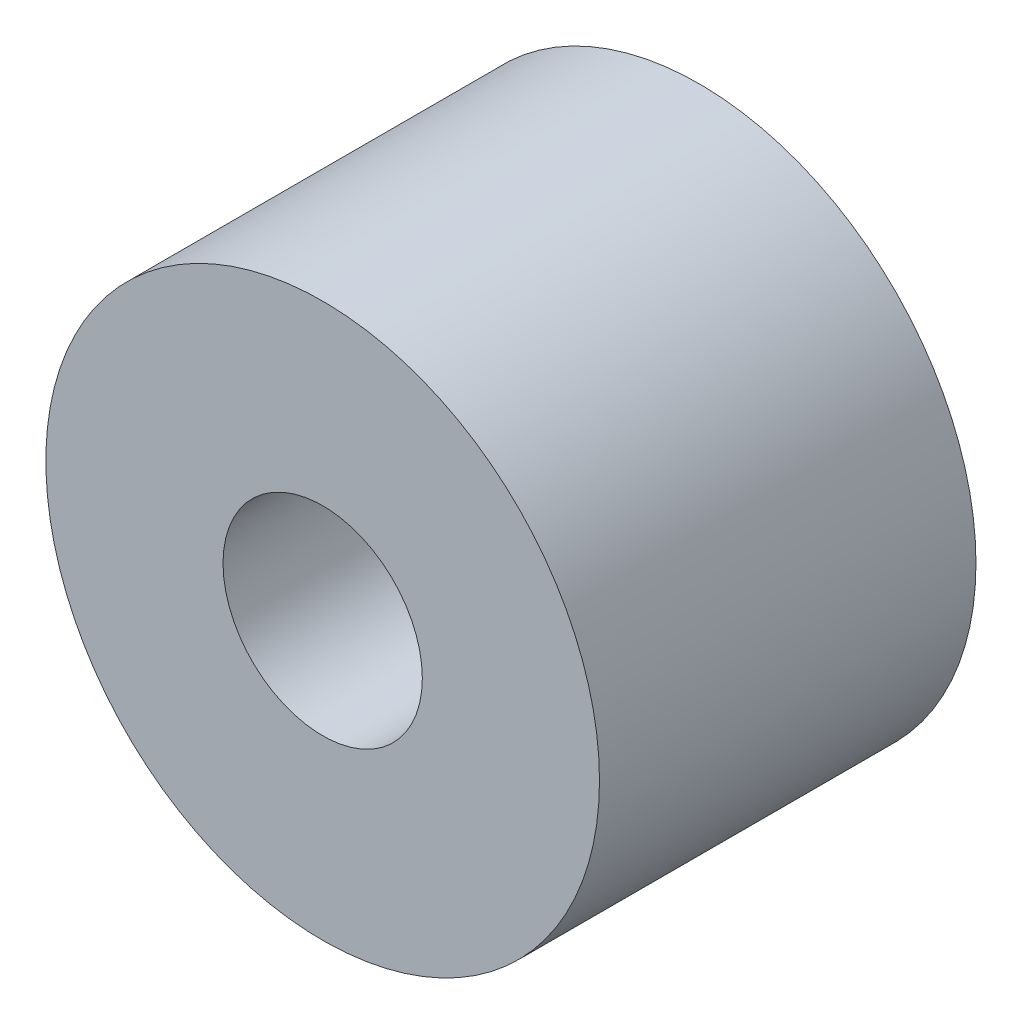
from build123d import *

# Parameters (mm, degrees)
ESBO_O1_R                = 12.5
ESBO_O1_R_2              = 4.5
RESSALTO_EXTRUS_O1_DEPTH = 17


with BuildPart() as part:
    # Esboço1 → Ressalto-extrusão1 (new body)
    with BuildSketch(Plane.XY):
        Circle(ESBO_O1_R)
        Circle(ESBO_O1_R_2, mode=Mode.SUBTRACT)
    extrude(amount=RESSALTO_EXTRUS_O1_DEPTH)


solid = part.part
